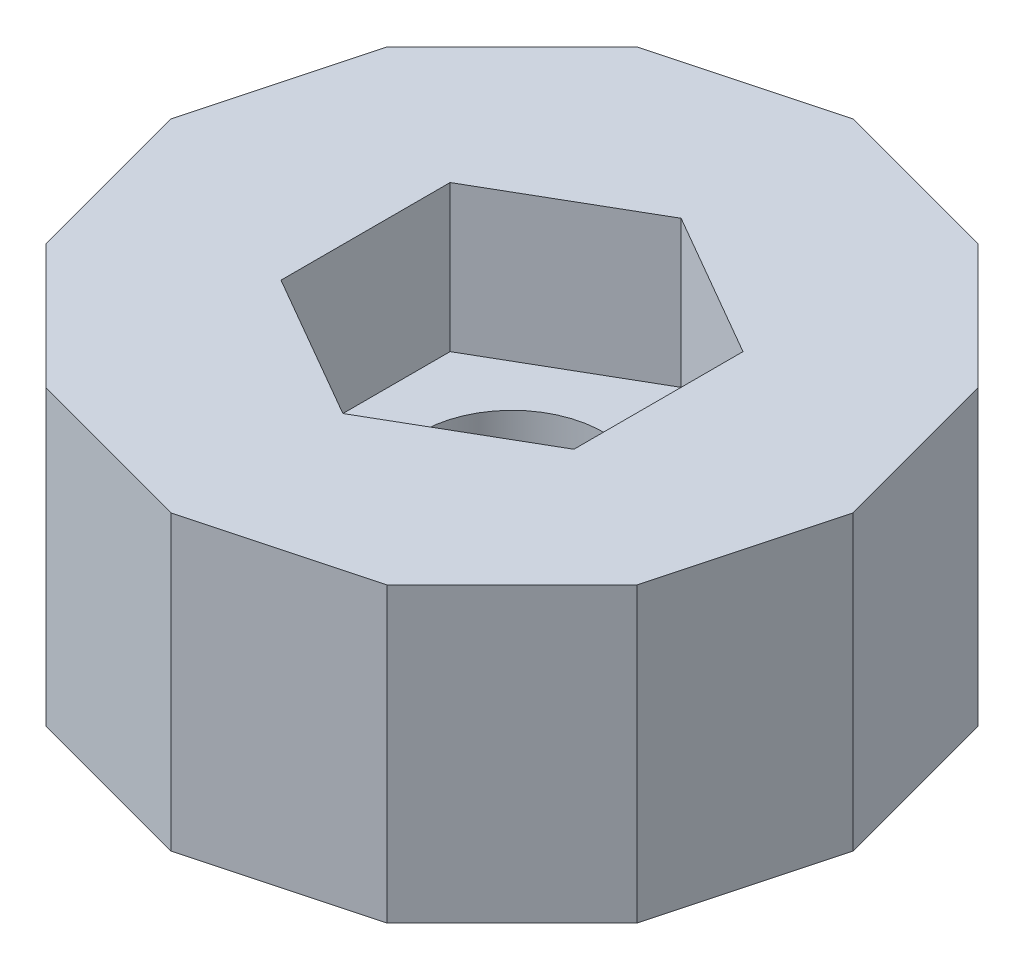
from build123d import *

# Parameters (mm, degrees)
RESSALTO_EXTRUS_O1_DEPTH = 8
ESBO_O1_3_R              = 2.5
RESSALTO_EXTRUS_O2_DEPTH = 4


with BuildPart() as part:
    # Esboço1 → Ressalto-extrusão1 (new body)
    with BuildSketch(Plane(origin=(0, 0, 0), x_dir=(1, 0, 0), z_dir=(0, 1, 0))):
        Polygon((4.658742812, 8.06917925), (0, 9.317485624), (-4.658742812, 8.06917925), (-8.06917925, 4.658742812), (-9.317485624, 0), (-8.06917925, -4.658742812), (-4.658742812, -8.06917925), (0, -9.317485624), (4.658742812, -8.06917925), (8.06917925, -4.658742812), (9.317485624, 0), (8.06917925, 4.658742812), align=None)
        Polygon((0, 4.618802154), (4, 2.309401077), (4, -2.309401077), (0, -4.618802154), (-4, -2.309401077), (-4, 2.309401077), align=None, mode=Mode.SUBTRACT)
    extrude(amount=RESSALTO_EXTRUS_O1_DEPTH)

    # Esboço1<3> → Ressalto-extrusão2 (add)
    with BuildSketch(Plane(origin=(0, 0, 0), x_dir=(1, 0, 0), z_dir=(0, 1, 0))):
        Polygon((4, 2.309401077), (0, 4.618802154), (-4, 2.309401077), (-4, -2.309401077), (0, -4.618802154), (4, -2.309401077), align=None)
        Circle(ESBO_O1_3_R, mode=Mode.SUBTRACT)
    extrude(amount=RESSALTO_EXTRUS_O2_DEPTH)


solid = part.part
